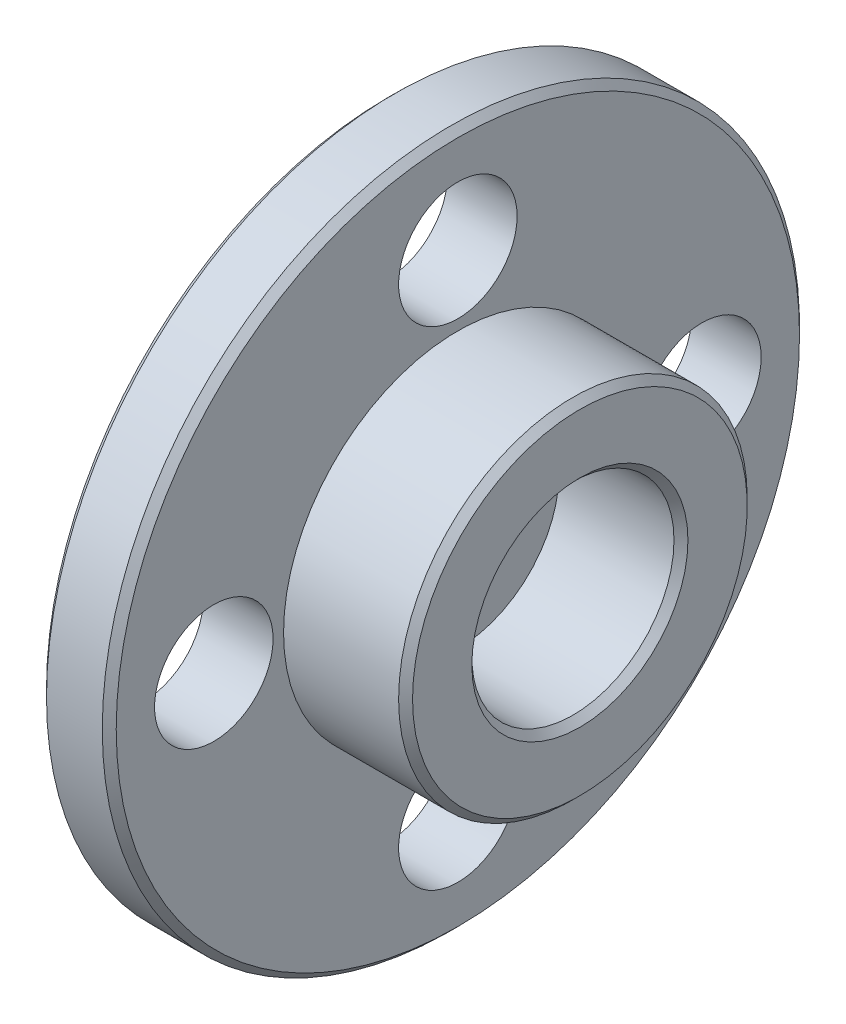
from build123d import *

# Parameters (mm, degrees)
SKETCH_2_R                  = 2.9
CUT_EXTRUDE_1_DEPTH         = 3.5
CUT_EXTRUDE_2_REACH         = 17.174
SKETCH_3_R                  = 1.5
HOLE_WIZARD_3_4_3_4_1_D     = 3.4
HOLE_WIZARD_3_4_3_4_1_DEPTH = 10
HOLE_WIZARD_3_4_3_4_1_TIP   = 1.021463052
CHAMFER_1_SIZE              = 0.2


with BuildPart() as part:
    # 草图1 → 旋转1 (revolve)
    with BuildSketch(Plane.XY, mode=Mode.PRIVATE) as revolve_1_sk:
        Polygon((0, 0), (0, 10), (2, 10), (2, 5), (5.5, 5), (5.5, 0), align=None)
    revolve(revolve_1_sk.sketch.rotate(Axis((0, 0, 0), (1, 0, 0)), 90), axis=Axis((0, 0, 0), (1, 0, 0)))

    # 草图2 → 切除-拉伸1 (cut)
    with BuildSketch(Plane(origin=(5.5, 0, 0), x_dir=(0, 0, -1), z_dir=(1, 0, 0))):
        Circle(SKETCH_2_R)
    extrude(amount=-CUT_EXTRUDE_1_DEPTH, mode=Mode.SUBTRACT)

    # 草图3 → 切除-拉伸2 (cut, up to next)
    with BuildSketch(Plane.ZY, mode=Mode.PRIVATE) as cut_extrude_2_sk1:
        Circle(SKETCH_3_R)
    cut_extrude_2_tool1 = extrude(cut_extrude_2_sk1.sketch, amount=-CUT_EXTRUDE_2_REACH, mode=Mode.PRIVATE) & part.part
    add(cut_extrude_2_tool1.solids().sort_by_distance((0, 0, 0))[0], mode=Mode.SUBTRACT)

    # Ø3.4 (3.4) 直径孔1
    with Locations(Plane(origin=(2, 0, 0), x_dir=(0, 0, -1), z_dir=(1, 0, 0))):
        with Locations((0, 7), (0, -7), (-7, 0), (7, 0)):
            Hole(HOLE_WIZARD_3_4_3_4_1_D / 2, depth=HOLE_WIZARD_3_4_3_4_1_DEPTH)
            with Locations((0, 0, -(HOLE_WIZARD_3_4_3_4_1_DEPTH + HOLE_WIZARD_3_4_3_4_1_TIP / 2))):  # 118° drill point
                Cone(0, HOLE_WIZARD_3_4_3_4_1_D / 2, HOLE_WIZARD_3_4_3_4_1_TIP, mode=Mode.SUBTRACT)

    # 倒角1
    chamfer_1_edges = [part.edges().sort_by_distance(p)[0] for p in [
        (5.5, 0, 2.9),
        (0, 0, -1.5),
        (5.5, 0, -5),
        (2, 0, -10),
        (0, 0, -10),
    ]]
    chamfer(chamfer_1_edges, length=CHAMFER_1_SIZE)


solid = part.part
